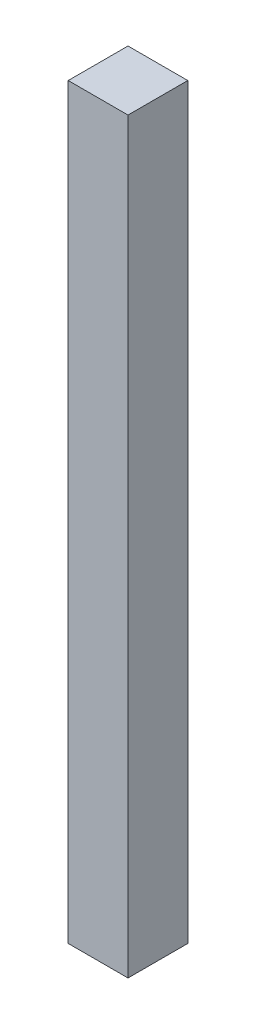
from build123d import *

# Parameters (mm, degrees)
SKETCH1_W           = 20
SKETCH1_H           = 20
BOSS_EXTRUDE1_DEPTH = 250


with BuildPart() as part:
    # Sketch1 → Boss-Extrude1 (new body)
    with BuildSketch(Plane(origin=(0, 0, 0), x_dir=(1, 0, 0), z_dir=(0, 1, 0))):
        Rectangle(SKETCH1_W, SKETCH1_H)
    extrude(amount=BOSS_EXTRUDE1_DEPTH)


solid = part.part
